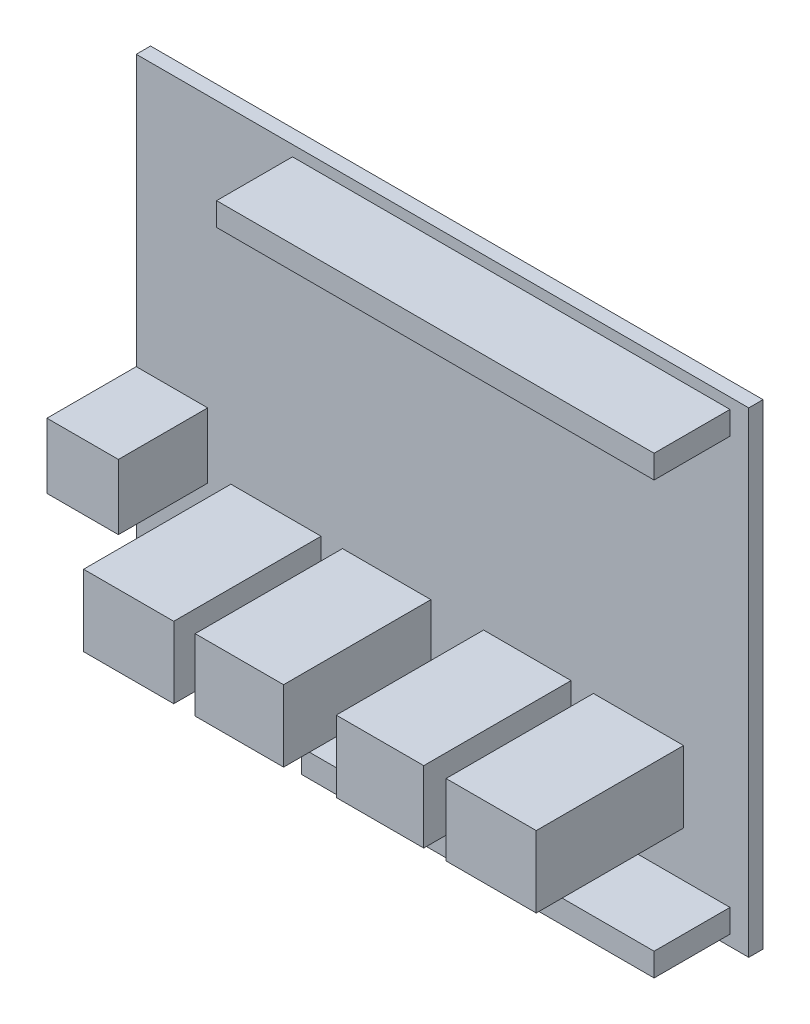
from build123d import *

# Parameters (mm, degrees)
SKETCH1_W           = 68.6
SKETCH1_H           = 53.3
BOSS_EXTRUDE1_DEPTH = 1.6
SKETCH2_W           = 10.1
SKETCH2_H           = 8
SKETCH2_W_2         = 9.9
SKETCH2_W_3         = 9.8
BOSS_EXTRUDE2_DEPTH = 18.1
SKETCH3_W           = 8
SKETCH3_H           = 7.3
BOSS_EXTRUDE3_DEPTH = 11.6
SKETCH4_W           = 49
SKETCH4_H           = 2.6
SKETCH4_W_2         = 39.5
BOSS_EXTRUDE4_DEPTH = 10.1


with BuildPart() as part:
    # Sketch1 → Boss-Extrude1 (new body)
    with BuildSketch(Plane.XY):
        with Locations((34.3, 26.65)):
            Rectangle(SKETCH1_W, SKETCH1_H)
    extrude(amount=BOSS_EXTRUDE1_DEPTH)

    # Sketch2 → Boss-Extrude2 (add)
    with BuildSketch(Plane.XY):
        with Locations((15.65, 12.9)):
            Rectangle(SKETCH2_W, SKETCH2_H)
        with Locations((28.05, 12.9)):
            Rectangle(SKETCH2_W_2, SKETCH2_H)
        with Locations((43.8, 12.9)):
            Rectangle(SKETCH2_W_3, SKETCH2_H)
        with Locations((56.25, 12.9)):
            Rectangle(SKETCH2_W, SKETCH2_H)
    extrude(amount=BOSS_EXTRUDE2_DEPTH)

    # Sketch3 → Boss-Extrude3 (add)
    with BuildSketch(Plane.XY):
        with Locations((4, 19.35)):
            Rectangle(SKETCH3_W, SKETCH3_H)
    extrude(amount=BOSS_EXTRUDE3_DEPTH)

    # Sketch4 → Boss-Extrude4 (add)
    with BuildSketch(Plane.XY):
        with Locations((42, 50.8)):
            Rectangle(SKETCH4_W, SKETCH4_H)
        with Locations((46.75, 2.5)):
            Rectangle(SKETCH4_W_2, SKETCH4_H)
    extrude(amount=BOSS_EXTRUDE4_DEPTH)


solid = part.part
